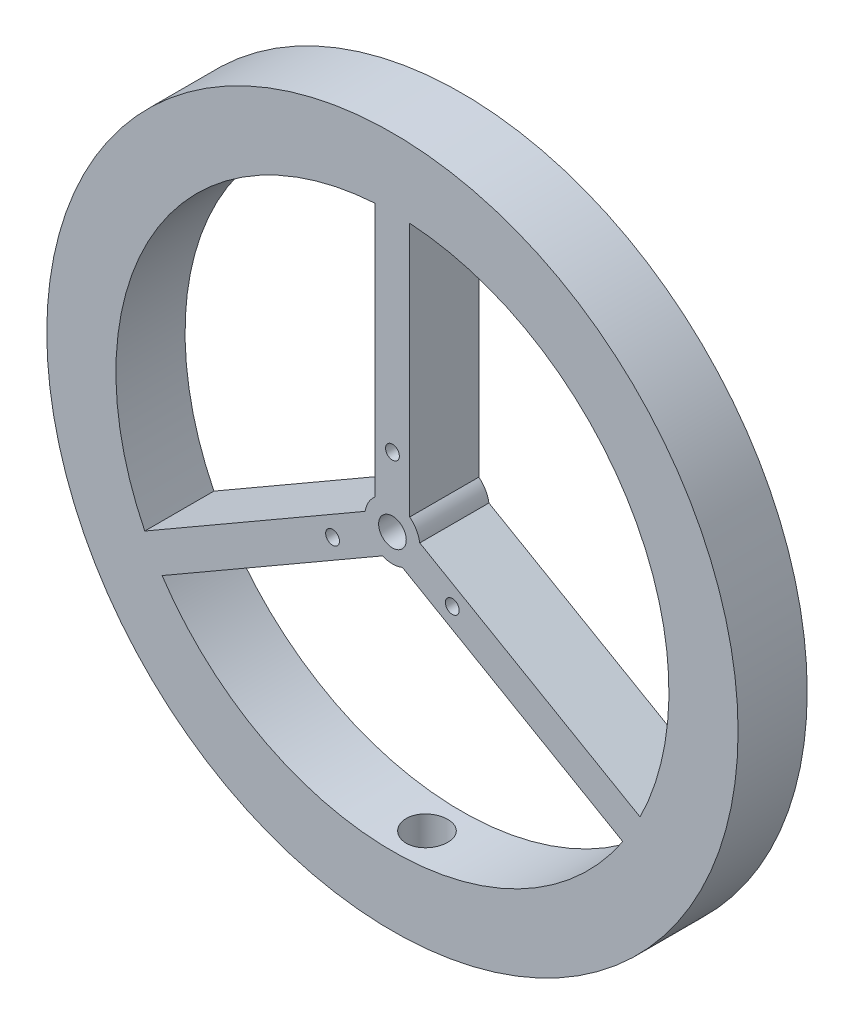
from build123d import *

# Parameters (mm, degrees)
SKETCH2_R           = 50
BOSS_EXTRUDE1_DEPTH = 10
SKETCH1_R           = 1
SKETCH1_R_2         = 2
CUT_EXTRUDE2_DEPTH  = 72.414284285
CUT_EXTRUDE3_START  = -10
SKETCH3_R           = 3
CUT_EXTRUDE3_DEPTH  = 62.414284285


with BuildPart() as part:
    # Sketch2 → Boss-Extrude1 (new body)
    with BuildSketch(Plane.XY):
        Circle(SKETCH2_R)
        with BuildLine():
            Line((2.5, 39.921798557), (2.5, 3.122498999))
            ThreePointArc((2.5, 3.122498999), (3.464101615, 2), (3.954163457, 0.60381401))
            Line((3.954163457, 0.60381401), (35.823291715, -17.795835769))
            ThreePointArc((35.823291715, -17.795835769), (34.641016151, 20), (2.5, 39.921798557))
        make_face(mode=Mode.SUBTRACT)
        with BuildLine():
            Line((-2.5, 39.921798557), (-2.5, 3.122498999))
            ThreePointArc((-2.5, 3.122498999), (-3.464101615, 2), (-3.954163457, 0.60381401))
            Line((-3.954163457, 0.60381401), (-35.823291715, -17.795835769))
            ThreePointArc((-35.823291715, -17.795835769), (-34.641016151, 20), (-2.5, 39.921798557))
        make_face(mode=Mode.SUBTRACT)
        with BuildLine():
            Line((33.323291715, -22.125962788), (1.454163457, -3.726313009))
            ThreePointArc((1.454163457, -3.726313009), (0, -4), (-1.454163457, -3.726313009))
            Line((-1.454163457, -3.726313009), (-33.323291715, -22.125962788))
            ThreePointArc((-33.323291715, -22.125962788), (0, -40), (33.323291715, -22.125962788))
        make_face(mode=Mode.SUBTRACT)
    extrude(amount=BOSS_EXTRUDE1_DEPTH)

    # Sketch1 → Cut-Extrude2 (cut, through all)
    with BuildSketch(Plane.XY):
        with Locations((0, 10)):
            Circle(SKETCH1_R)
        Circle(SKETCH1_R_2)
        with Locations((-8.660254038, -5)):
            Circle(SKETCH1_R)
        with Locations((8.660254038, -5)):
            Circle(SKETCH1_R)
    extrude(amount=CUT_EXTRUDE2_DEPTH, mode=Mode.SUBTRACT)

    # Sketch3 → Cut-Extrude3 (cut, through all)
    with BuildSketch(Plane(origin=(0, 0, 0), x_dir=(1, 0, 0), z_dir=(0, 1, 0)).offset(CUT_EXTRUDE3_START)):
        with Locations(Location((0, -5, 0), (0, 0, 270))):
            Circle(SKETCH3_R)
    extrude(amount=-CUT_EXTRUDE3_DEPTH, mode=Mode.SUBTRACT)


solid = part.part
